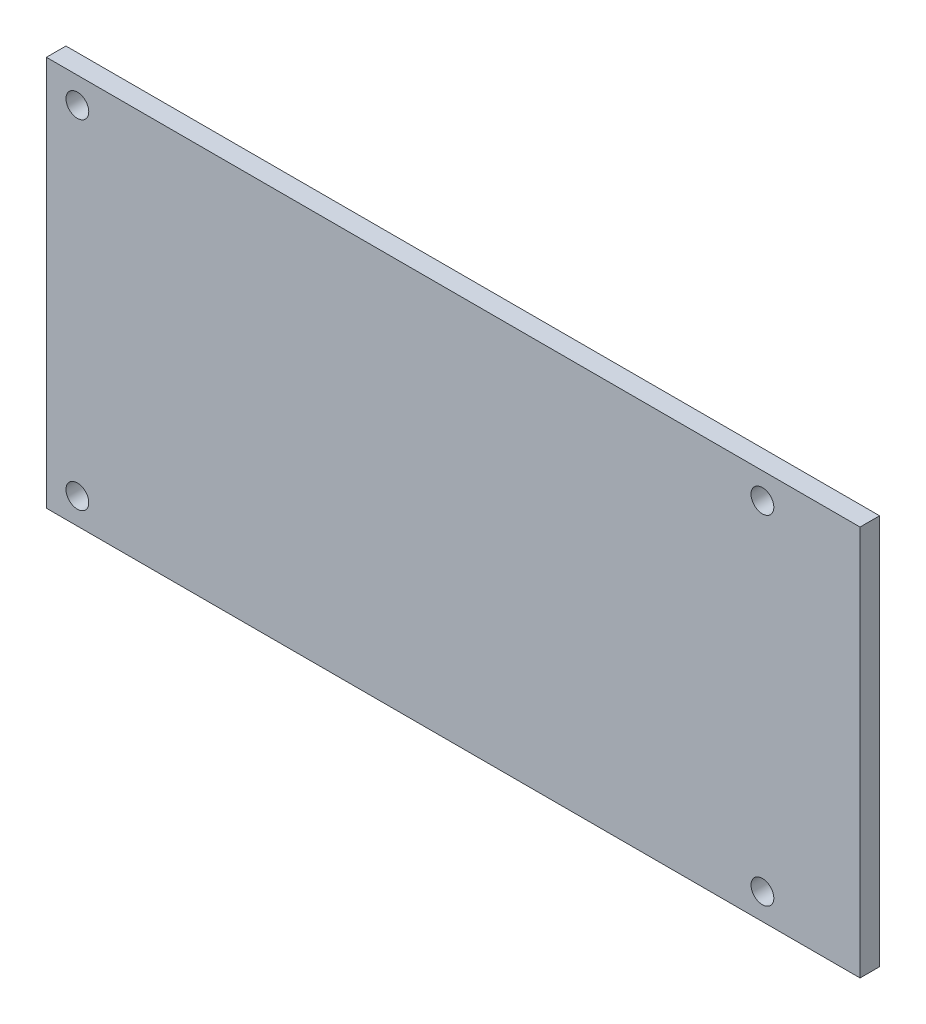
from build123d import *

# Parameters (mm, degrees)
SKETCH_1_W      = 125
SKETCH_1_H      = 60
SKETCH_1_R      = 1.75
EXTRUDE_1_DEPTH = 3


with BuildPart() as part:
    # Эскиз1 → Бобышка-Вытянуть1 (new body)
    with BuildSketch(Plane.XY):
        Rectangle(SKETCH_1_W, SKETCH_1_H)
        with Locations((47.5, 26)):
            Circle(SKETCH_1_R, mode=Mode.SUBTRACT)
        with Locations((-57.7426005, 26)):
            Circle(SKETCH_1_R, mode=Mode.SUBTRACT)
        with Locations(Location((47.5, -26, 0), (0, 0, 180))):
            Circle(SKETCH_1_R, mode=Mode.SUBTRACT)
        with Locations(Location((-57.7426005, -26, 0), (0, 0, 180))):
            Circle(SKETCH_1_R, mode=Mode.SUBTRACT)
    extrude(amount=EXTRUDE_1_DEPTH)


solid = part.part
